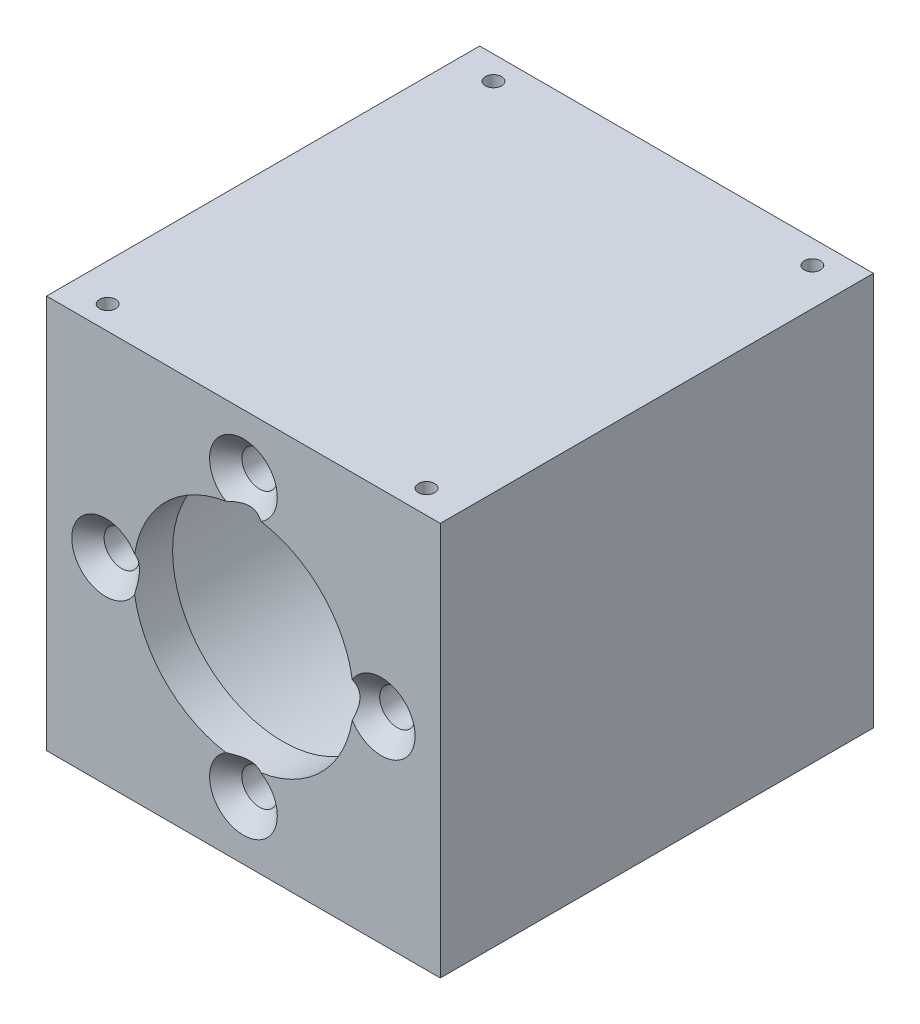
from build123d import *

# Parameters (mm, degrees)
SKETCH_1_W                = 50
SKETCH_1_H                = 50
SKETCH_1_R                = 14
EXTRUDE_2_DEPTH           = 27.5
SKETCH_3_R                = 21
CUT_EXTRUDE_2_DEPTH       = 50
HOLE_WIZARD_M2_5_1_D      = 2.05
HOLE_WIZARD_M2_5_1_DEPTH  = 7.25
HOLE_WIZARD_M2_5_1_TIP    = 0.615882135
HOLE_WIZARD_1_D           = 4.5
HOLE_WIZARD_1_CSINK_D     = 8.6
HOLE_WIZARD_1_CSINK_ANGLE = 90
HOLE_WIZARD_M4_1_D        = 3.3
HOLE_WIZARD_M4_1_DEPTH    = 8.1
HOLE_WIZARD_M4_1_TIP      = 0.991420021


with BuildPart() as part:
    # 草图1 → 凸台-拉伸2 (new, symmetric)
    with BuildSketch(Plane.XY):
        Rectangle(SKETCH_1_W, SKETCH_1_H)
        Circle(SKETCH_1_R, mode=Mode.SUBTRACT)
    extrude(amount=EXTRUDE_2_DEPTH, both=True)

    # 草图3 → 切除-拉伸2 (cut)
    with BuildSketch(Plane(origin=(0, 0, -27.5), x_dir=(-1, 0, 0), z_dir=(0, 0, -1))):
        Circle(SKETCH_3_R)
    extrude(amount=-CUT_EXTRUDE_2_DEPTH, mode=Mode.SUBTRACT)

    # M2.5 螺纹孔1
    with Locations(Plane(origin=(-9.644019955, 25, 9.714634246), x_dir=(1, 0, 0), z_dir=(0, 1, 0))):
        with Locations((29.894019955, 34.214634246), (-10.605980045, -14.785365754), (-10.605980045, 34.214634246), (29.894019955, -14.785365754)):
            Hole(HOLE_WIZARD_M2_5_1_D / 2, depth=HOLE_WIZARD_M2_5_1_DEPTH)
            with Locations((0, 0, -(HOLE_WIZARD_M2_5_1_DEPTH + HOLE_WIZARD_M2_5_1_TIP / 2))):  # 118° drill point
                Cone(0, HOLE_WIZARD_M2_5_1_D / 2, HOLE_WIZARD_M2_5_1_TIP, mode=Mode.SUBTRACT)

    # 打孔尺寸(%根据十字)槽沉头木螺钉的类型1 (through all)
    with Locations(Plane.XY.offset(27.5)):
        with Locations((0, 17.5), (17.5, 0), (0, -17.5), (-17.5, 0)):
            CounterSinkHole(HOLE_WIZARD_1_D / 2, HOLE_WIZARD_1_CSINK_D / 2, counter_sink_angle=HOLE_WIZARD_1_CSINK_ANGLE)

    # M4 螺纹孔1
    with Locations(Plane(origin=(0.5, -25, 0), x_dir=(0, 0, 1), z_dir=(0, -1, 0))):
        with Locations((23.5, 21.5), (-23.5, -20.5), (-23.5, 21.5), (23.5, -20.5)):
            Hole(HOLE_WIZARD_M4_1_D / 2, depth=HOLE_WIZARD_M4_1_DEPTH)
            with Locations((0, 0, -(HOLE_WIZARD_M4_1_DEPTH + HOLE_WIZARD_M4_1_TIP / 2))):  # 118° drill point
                Cone(0, HOLE_WIZARD_M4_1_D / 2, HOLE_WIZARD_M4_1_TIP, mode=Mode.SUBTRACT)


solid = part.part
